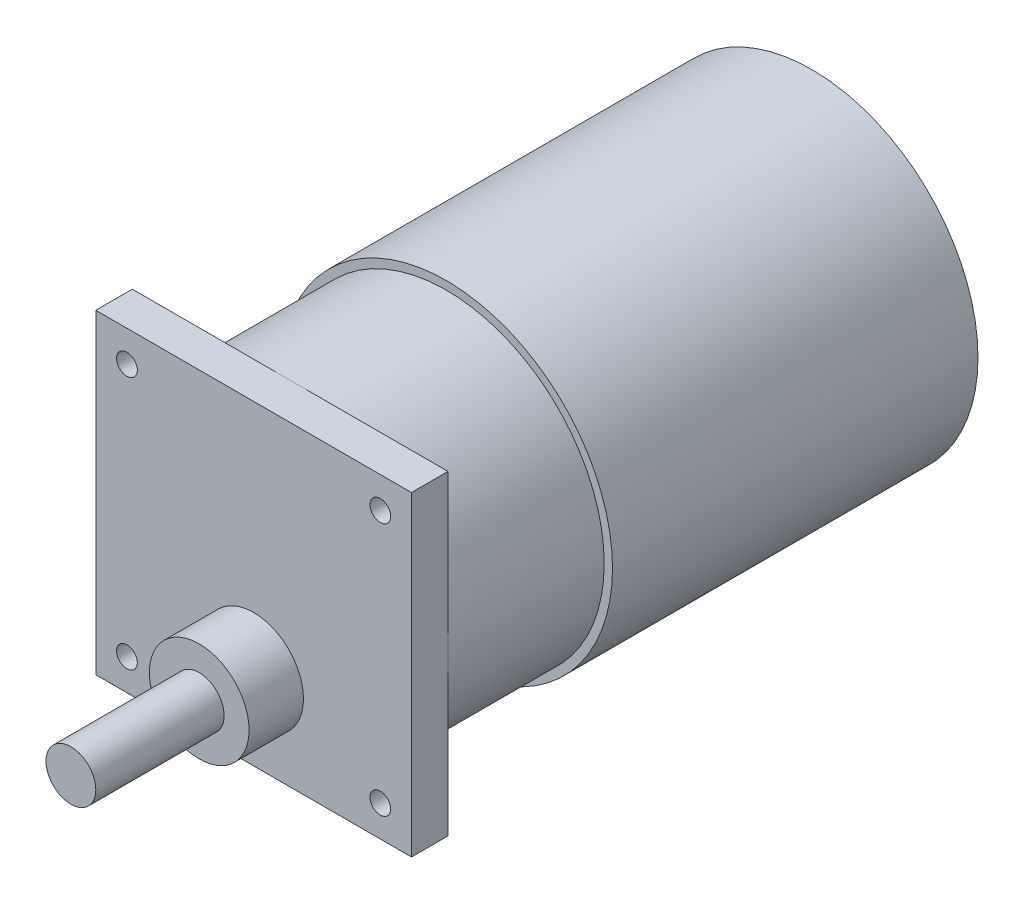
from build123d import *

# Parameters (mm, degrees)
ESQUISSE1_R      = 20
EXTRUSION1_DEPTH = 44
ESQUISSE2_R      = 19
EXTRUSION2_DEPTH = 18.8
ESQUISSE3_W      = 38
ESQUISSE3_H      = 38
EXTRUSION3_DEPTH = 4.4
ESQUISSE4_R      = 1.25
EXTRUSION4_DEPTH = 73.909807296
ESQUISSE5_R      = 6
EXTRUSION5_DEPTH = 6.55
ESQUISSE6_R      = 3
EXTRUSION6_DEPTH = 15.45


with BuildPart() as part:
    # Esquisse1 → Extrusion1 (new body)
    with BuildSketch(Plane.XY):
        Circle(ESQUISSE1_R)
    extrude(amount=EXTRUSION1_DEPTH)

    # Esquisse2 → Extrusion2 (add)
    with BuildSketch(Plane.XY.offset(44)):
        Circle(ESQUISSE2_R)
    extrude(amount=EXTRUSION2_DEPTH)

    # Esquisse3 → Extrusion3 (add)
    with BuildSketch(Plane.XY.offset(62.8)):
        Rectangle(ESQUISSE3_W, ESQUISSE3_H)
    extrude(amount=EXTRUSION3_DEPTH)

    # Esquisse4 → Extrusion4 (cut, through all)
    with BuildSketch(Plane.XY.offset(67.2)):
        with Locations((-15.25, 15.25)):
            Circle(ESQUISSE4_R)
        with Locations((15.25, 15.25)):
            Circle(ESQUISSE4_R)
        with Locations((15.25, -15.25)):
            Circle(ESQUISSE4_R)
        with Locations((-15.25, -15.25)):
            Circle(ESQUISSE4_R)
    extrude(amount=-EXTRUSION4_DEPTH, mode=Mode.SUBTRACT)

    # Esquisse5 → Extrusion5 (add)
    with BuildSketch(Plane.XY.offset(67.2)):
        with Locations((0, -9)):
            Circle(ESQUISSE5_R)
    extrude(amount=EXTRUSION5_DEPTH)

    # Esquisse6 → Extrusion6 (add)
    with BuildSketch(Plane.XY.offset(73.75)):
        with Locations((0, -9)):
            Circle(ESQUISSE6_R)
    extrude(amount=EXTRUSION6_DEPTH)


solid = part.part
